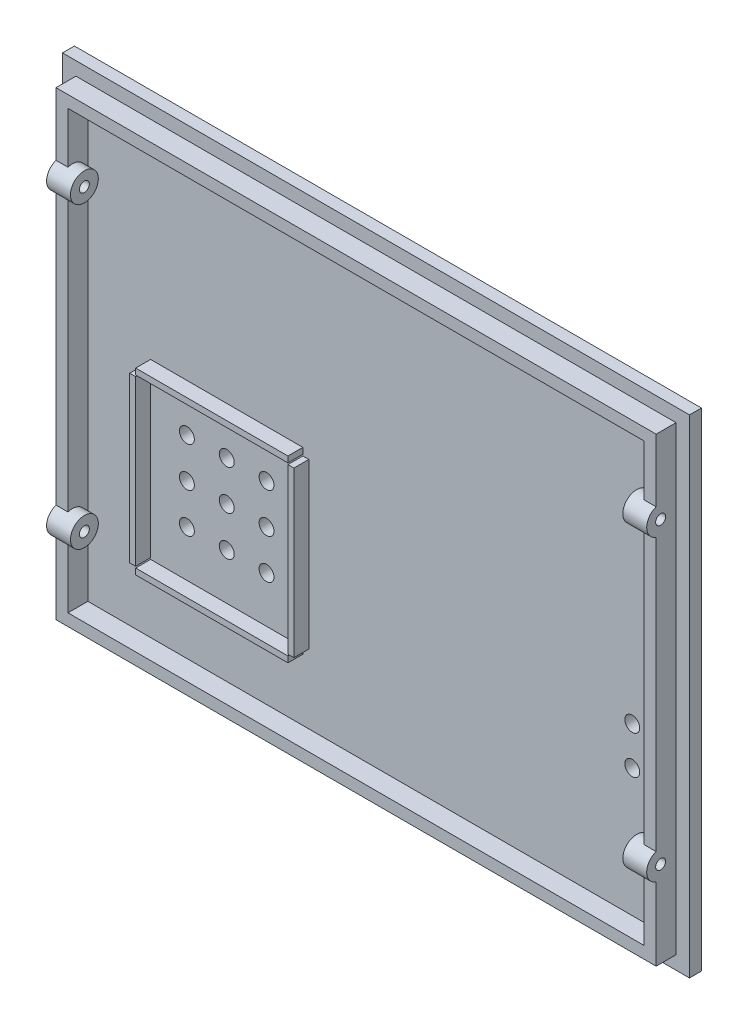
from build123d import *

# Parameters (mm, degrees)
BOSS_EXTRUDE1_START  = 36
SKETCH1_W            = 126
SKETCH1_H            = 98
BOSS_EXTRUDE1_DEPTH  = 2.4
BOSS_EXTRUDE2_START  = 37.9
SKETCH2_W            = 120.6
SKETCH2_H            = 92.6
BOSS_EXTRUDE2_DEPTH  = 4.5
BOSS_EXTRUDE3_START  = 38.4
SKETCH3_W            = 115.8
SKETCH3_H            = 87.8
BOSS_EXTRUDE3_DEPTH  = 5
BOSS_EXTRUDE4_START  = -60.3
SKETCH4_R            = 2.8
BOSS_EXTRUDE4_DEPTH  = 4.8
BOSS_EXTRUDE5_START  = -61
SKETCH5_R            = 1
BOSS_EXTRUDE5_DEPTH  = 6.5
BOSS_EXTRUDE6_START  = -60.3
SKETCH6_R            = 2.8
BOSS_EXTRUDE6_DEPTH  = 4.8
BOSS_EXTRUDE7_START  = -61
SKETCH7_R            = 1
BOSS_EXTRUDE7_DEPTH  = 6.5
BOSS_EXTRUDE8_START  = 55.5
SKETCH8_R            = 2.8
BOSS_EXTRUDE8_DEPTH  = 4.8
BOSS_EXTRUDE9_START  = 54.5
SKETCH9_R            = 1
BOSS_EXTRUDE9_DEPTH  = 6.5
BOSS_EXTRUDE10_START = 55.5
SKETCH10_R           = 2.8
BOSS_EXTRUDE10_DEPTH = 4.8
BOSS_EXTRUDE11_START = 54.5
SKETCH11_R           = 1
BOSS_EXTRUDE11_DEPTH = 6.5
BOSS_EXTRUDE12_START = 35
SKETCH12_R           = 1.5
BOSS_EXTRUDE12_DEPTH = 4.4
BOSS_EXTRUDE13_START = 35
SKETCH13_R           = 1.5
BOSS_EXTRUDE13_DEPTH = 4.4
BOSS_EXTRUDE14_START = 35
SKETCH14_R           = 1.5
BOSS_EXTRUDE14_DEPTH = 4.4
BOSS_EXTRUDE15_START = 35
SKETCH15_R           = 1.5
BOSS_EXTRUDE15_DEPTH = 4.4
BOSS_EXTRUDE16_START = 35
SKETCH16_R           = 1.5
BOSS_EXTRUDE16_DEPTH = 4.4
BOSS_EXTRUDE17_START = 35
SKETCH17_R           = 1.5
BOSS_EXTRUDE17_DEPTH = 4.4
BOSS_EXTRUDE18_START = 35
SKETCH18_R           = 1.5
BOSS_EXTRUDE18_DEPTH = 4.4
BOSS_EXTRUDE19_START = 35
SKETCH19_R           = 1.5
BOSS_EXTRUDE19_DEPTH = 4.4
BOSS_EXTRUDE20_START = 35
SKETCH20_R           = 1.5
BOSS_EXTRUDE20_DEPTH = 4.4
BOSS_EXTRUDE21_START = 38.4
SKETCH21_W           = 1.2
SKETCH21_H           = 33
BOSS_EXTRUDE21_DEPTH = 3
BOSS_EXTRUDE22_START = 38.4
SKETCH22_W           = 1.2
SKETCH22_H           = 33
BOSS_EXTRUDE22_DEPTH = 3
BOSS_EXTRUDE23_START = 38.4
SKETCH23_W           = 30.6
SKETCH23_H           = 1.2
BOSS_EXTRUDE23_DEPTH = 3
BOSS_EXTRUDE24_START = 38.4
SKETCH24_W           = 30.6
SKETCH24_H           = 1.2
BOSS_EXTRUDE24_DEPTH = 3
BOSS_EXTRUDE25_START = 35
SKETCH25_R           = 1.5
BOSS_EXTRUDE25_DEPTH = 4.4
BOSS_EXTRUDE26_START = 35
SKETCH26_R           = 1.5
BOSS_EXTRUDE26_DEPTH = 4.4


with BuildPart() as part:
    # Sketch1 → Boss-Extrude1 (new body)
    with BuildSketch(Plane.XY.offset(BOSS_EXTRUDE1_START)):
        with Locations((0, 109)):
            Rectangle(SKETCH1_W, SKETCH1_H)
    extrude(amount=BOSS_EXTRUDE1_DEPTH)

    # Sketch2 → Boss-Extrude2 (add)
    with BuildSketch(Plane.XY.offset(BOSS_EXTRUDE2_START)):
        with Locations((0, 109)):
            Rectangle(SKETCH2_W, SKETCH2_H)
    extrude(amount=BOSS_EXTRUDE2_DEPTH)


with BuildPart() as body_2:
    # Sketch3 → Boss-Extrude3 (new body)
    with BuildSketch(Plane.XY.offset(BOSS_EXTRUDE3_START)):
        with Locations((0, 109)):
            Rectangle(SKETCH3_W, SKETCH3_H)
    extrude(amount=BOSS_EXTRUDE3_DEPTH)


with BuildPart() as part_1:
    add(part.part)

    # Combine1: cut body 2
    add(body_2.part, mode=Mode.SUBTRACT)

    # Sketch4 → Boss-Extrude4 (add)
    with BuildSketch(Plane(origin=(0, 0, 0), x_dir=(0, 0, -1), z_dir=(1, 0, 0)).offset(BOSS_EXTRUDE4_START)):
        with Locations((-41.5, 80)):
            Circle(SKETCH4_R)
    extrude(amount=BOSS_EXTRUDE4_DEPTH)


with BuildPart() as body_2_2:
    # Sketch5 → Boss-Extrude5 (new body)
    with BuildSketch(Plane(origin=(0, 0, 0), x_dir=(0, 0, -1), z_dir=(1, 0, 0)).offset(BOSS_EXTRUDE5_START)):
        with Locations((-41.5, 80)):
            Circle(SKETCH5_R)
    extrude(amount=BOSS_EXTRUDE5_DEPTH)


with BuildPart() as part_2:
    add(part_1.part)

    # Combine2: cut body 2 2
    add(body_2_2.part, mode=Mode.SUBTRACT)

    # Sketch6 → Boss-Extrude6 (add)
    with BuildSketch(Plane(origin=(0, 0, 0), x_dir=(0, 0, -1), z_dir=(1, 0, 0)).offset(BOSS_EXTRUDE6_START)):
        with Locations((-41.5, 140)):
            Circle(SKETCH6_R)
    extrude(amount=BOSS_EXTRUDE6_DEPTH)


with BuildPart() as body_2_3:
    # Sketch7 → Boss-Extrude7 (new body)
    with BuildSketch(Plane(origin=(0, 0, 0), x_dir=(0, 0, -1), z_dir=(1, 0, 0)).offset(BOSS_EXTRUDE7_START)):
        with Locations((-41.5, 140)):
            Circle(SKETCH7_R)
    extrude(amount=BOSS_EXTRUDE7_DEPTH)


with BuildPart() as part_3:
    add(part_2.part)

    # Combine3: cut body 2 3
    add(body_2_3.part, mode=Mode.SUBTRACT)

    # Sketch8 → Boss-Extrude8 (add)
    with BuildSketch(Plane(origin=(0, 0, 0), x_dir=(0, 0, -1), z_dir=(1, 0, 0)).offset(BOSS_EXTRUDE8_START)):
        with Locations((-41.5, 80)):
            Circle(SKETCH8_R)
    extrude(amount=BOSS_EXTRUDE8_DEPTH)


with BuildPart() as body_2_4:
    # Sketch9 → Boss-Extrude9 (new body)
    with BuildSketch(Plane(origin=(0, 0, 0), x_dir=(0, 0, -1), z_dir=(1, 0, 0)).offset(BOSS_EXTRUDE9_START)):
        with Locations((-41.5, 80)):
            Circle(SKETCH9_R)
    extrude(amount=BOSS_EXTRUDE9_DEPTH)


with BuildPart() as part_4:
    add(part_3.part)

    # Combine4: cut body 2 4
    add(body_2_4.part, mode=Mode.SUBTRACT)

    # Sketch10 → Boss-Extrude10 (add)
    with BuildSketch(Plane(origin=(0, 0, 0), x_dir=(0, 0, -1), z_dir=(1, 0, 0)).offset(BOSS_EXTRUDE10_START)):
        with Locations((-41.5, 140)):
            Circle(SKETCH10_R)
    extrude(amount=BOSS_EXTRUDE10_DEPTH)


with BuildPart() as body_2_5:
    # Sketch11 → Boss-Extrude11 (new body)
    with BuildSketch(Plane(origin=(0, 0, 0), x_dir=(0, 0, -1), z_dir=(1, 0, 0)).offset(BOSS_EXTRUDE11_START)):
        with Locations((-41.5, 140)):
            Circle(SKETCH11_R)
    extrude(amount=BOSS_EXTRUDE11_DEPTH)


with BuildPart() as part_5:
    add(part_4.part)

    # Combine5: cut body 2 5
    add(body_2_5.part, mode=Mode.SUBTRACT)


with BuildPart() as body_2_6:
    # Sketch12 → Boss-Extrude12 (new body)
    with BuildSketch(Plane.XY.offset(BOSS_EXTRUDE12_START)):
        with Locations((-38, 88)):
            Circle(SKETCH12_R)
    extrude(amount=BOSS_EXTRUDE12_DEPTH)


with BuildPart() as part_6:
    add(part_5.part)

    # Combine6: cut body 2 6
    add(body_2_6.part, mode=Mode.SUBTRACT)


with BuildPart() as body_2_7:
    # Sketch13 → Boss-Extrude13 (new body)
    with BuildSketch(Plane.XY.offset(BOSS_EXTRUDE13_START)):
        with Locations((-38, 96)):
            Circle(SKETCH13_R)
    extrude(amount=BOSS_EXTRUDE13_DEPTH)


with BuildPart() as part_7:
    add(part_6.part)

    # Combine7: cut body 2 7
    add(body_2_7.part, mode=Mode.SUBTRACT)


with BuildPart() as body_2_8:
    # Sketch14 → Boss-Extrude14 (new body)
    with BuildSketch(Plane.XY.offset(BOSS_EXTRUDE14_START)):
        with Locations((-38, 104)):
            Circle(SKETCH14_R)
    extrude(amount=BOSS_EXTRUDE14_DEPTH)


with BuildPart() as part_8:
    add(part_7.part)

    # Combine8: cut body 2 8
    add(body_2_8.part, mode=Mode.SUBTRACT)


with BuildPart() as body_2_9:
    # Sketch15 → Boss-Extrude15 (new body)
    with BuildSketch(Plane.XY.offset(BOSS_EXTRUDE15_START)):
        with Locations((-30, 88)):
            Circle(SKETCH15_R)
    extrude(amount=BOSS_EXTRUDE15_DEPTH)


with BuildPart() as part_9:
    add(part_8.part)

    # Combine9: cut body 2 9
    add(body_2_9.part, mode=Mode.SUBTRACT)


with BuildPart() as body_2_10:
    # Sketch16 → Boss-Extrude16 (new body)
    with BuildSketch(Plane.XY.offset(BOSS_EXTRUDE16_START)):
        with Locations((-30, 96)):
            Circle(SKETCH16_R)
    extrude(amount=BOSS_EXTRUDE16_DEPTH)


with BuildPart() as part_10:
    add(part_9.part)

    # Combine10: cut body 2 10
    add(body_2_10.part, mode=Mode.SUBTRACT)


with BuildPart() as body_2_11:
    # Sketch17 → Boss-Extrude17 (new body)
    with BuildSketch(Plane.XY.offset(BOSS_EXTRUDE17_START)):
        with Locations((-30, 104)):
            Circle(SKETCH17_R)
    extrude(amount=BOSS_EXTRUDE17_DEPTH)


with BuildPart() as part_11:
    add(part_10.part)

    # Combine11: cut body 2 11
    add(body_2_11.part, mode=Mode.SUBTRACT)


with BuildPart() as body_2_12:
    # Sketch18 → Boss-Extrude18 (new body)
    with BuildSketch(Plane.XY.offset(BOSS_EXTRUDE18_START)):
        with Locations((-22, 88)):
            Circle(SKETCH18_R)
    extrude(amount=BOSS_EXTRUDE18_DEPTH)


with BuildPart() as part_12:
    add(part_11.part)

    # Combine12: cut body 2 12
    add(body_2_12.part, mode=Mode.SUBTRACT)


with BuildPart() as body_2_13:
    # Sketch19 → Boss-Extrude19 (new body)
    with BuildSketch(Plane.XY.offset(BOSS_EXTRUDE19_START)):
        with Locations((-22, 96)):
            Circle(SKETCH19_R)
    extrude(amount=BOSS_EXTRUDE19_DEPTH)


with BuildPart() as part_13:
    add(part_12.part)

    # Combine13: cut body 2 13
    add(body_2_13.part, mode=Mode.SUBTRACT)


with BuildPart() as body_2_14:
    # Sketch20 → Boss-Extrude20 (new body)
    with BuildSketch(Plane.XY.offset(BOSS_EXTRUDE20_START)):
        with Locations((-22, 104)):
            Circle(SKETCH20_R)
    extrude(amount=BOSS_EXTRUDE20_DEPTH)


with BuildPart() as part_14:
    add(part_13.part)

    # Combine14: cut body 2 14
    add(body_2_14.part, mode=Mode.SUBTRACT)

    # Sketch21 → Boss-Extrude21 (add)
    with BuildSketch(Plane.XY.offset(BOSS_EXTRUDE21_START)):
        with Locations((-45.9, 95.5)):
            Rectangle(SKETCH21_W, SKETCH21_H)
    extrude(amount=BOSS_EXTRUDE21_DEPTH)

    # Sketch22 → Boss-Extrude22 (add)
    with BuildSketch(Plane.XY.offset(BOSS_EXTRUDE22_START)):
        with Locations((-14.1, 95.5)):
            Rectangle(SKETCH22_W, SKETCH22_H)
    extrude(amount=BOSS_EXTRUDE22_DEPTH)

    # Sketch23 → Boss-Extrude23 (add)
    with BuildSketch(Plane.XY.offset(BOSS_EXTRUDE23_START)):
        with Locations((-30, 112.9)):
            Rectangle(SKETCH23_W, SKETCH23_H)
    extrude(amount=BOSS_EXTRUDE23_DEPTH)

    # Sketch24 → Boss-Extrude24 (add)
    with BuildSketch(Plane.XY.offset(BOSS_EXTRUDE24_START)):
        with Locations((-30, 78.1)):
            Rectangle(SKETCH24_W, SKETCH24_H)
    extrude(amount=BOSS_EXTRUDE24_DEPTH)


with BuildPart() as body_2_15:
    # Sketch25 → Boss-Extrude25 (new body)
    with BuildSketch(Plane.XY.offset(BOSS_EXTRUDE25_START)):
        with Locations((51.5, 98.5)):
            Circle(SKETCH25_R)
    extrude(amount=BOSS_EXTRUDE25_DEPTH)


with BuildPart() as part_15:
    add(part_14.part)

    # Combine15: cut body 2 15
    add(body_2_15.part, mode=Mode.SUBTRACT)


with BuildPart() as body_2_16:
    # Sketch26 → Boss-Extrude26 (new body)
    with BuildSketch(Plane.XY.offset(BOSS_EXTRUDE26_START)):
        with Locations((51.5, 90.8)):
            Circle(SKETCH26_R)
    extrude(amount=BOSS_EXTRUDE26_DEPTH)


with BuildPart() as part_16:
    add(part_15.part)

    # Combine16: cut body 2 16
    add(body_2_16.part, mode=Mode.SUBTRACT)


solid = part_16.part
